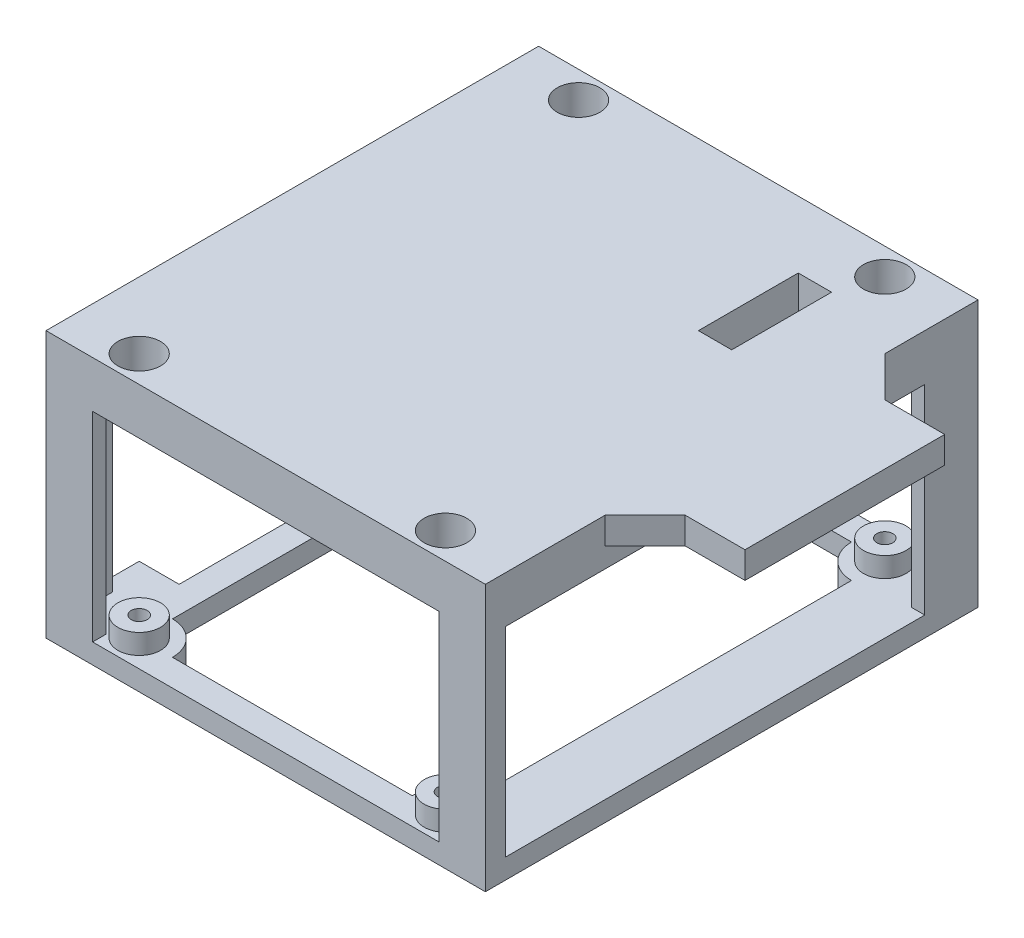
from build123d import *

# Parameters (mm, degrees)
SKETCH1_W                             = 66
SKETCH1_H                             = 74
SKETCH1_R                             = 1.2
MAIN_OUTER_CONNECTION_DEPTH           = 40
SKETCH2_W                             = 62
SKETCH2_H                             = 30
HOLE_FOR_PROTOBOARD_ACCESS_DEPTH      = 107.920531237
SKETCH16_W                            = 5
SKETCH16_H                            = 30
WALL_FOR_SCREW_TERMINAL_REPLACE_DEPTH = 2
SKETCH18_W                            = 58
SKETCH18_H                            = 30
HOLE_FOR_WIRE_CONNECTIONS_DEPTH       = 107.920531237
HOLE_FOR_SCREW_TERMINAL_REPLACE_REACH = 108.921
SKETCH18_3_W                          = 5
SKETCH18_3_H                          = 30
SKETCH1_3_W                           = 6
SKETCH1_3_H                           = 46
HOLE_FOR_WIRE_IN_BOTTOM_DEPTH         = 10
BOLT_START                            = 33
SKETCH1_5_R                           = 3.2
SKETCH1_5_R_2                         = 1.2
BOLT_HEAD_CLEARANCE_DEPTH             = 7
STANDOFF_START                        = 3
SKETCH1_6_R                           = 3.2
SKETCH1_6_R_2                         = 1.2
STANDOFF_FOR_WIRE_CLEARANCE_DEPTH     = 3
BREAKOUT_START                        = 36
SKETCH1_8_W                           = 15
SKETCH1_8_H                           = 30
BREAKOUT_BOARD_COVER_DEPTH            = 4
CUT_EXTRUDE14_START                   = 40
SKETCH1_9_W                           = 5
SKETCH1_9_H                           = 15
CUT_EXTRUDE14_DEPTH                   = 7
CHAMFER2_SIZE                         = 6


with BuildPart() as part:
    # Sketch1 → Main Outer Connection (new body)
    with BuildSketch(Plane(origin=(0, 0, 0), x_dir=(1, 0, 0), z_dir=(0, 1, 0))):
        with Locations((33, 37)):
            Rectangle(SKETCH1_W, SKETCH1_H)
        with Locations(Location((10, 70, 0), (0, 0, 270))):
            Circle(SKETCH1_R, mode=Mode.SUBTRACT)
        with Locations(Location((56, 70, 0), (0, 0, 270))):
            Circle(SKETCH1_R, mode=Mode.SUBTRACT)
        with Locations(Location((10, 4, 0), (0, 0, 270))):
            Circle(SKETCH1_R, mode=Mode.SUBTRACT)
        with Locations(Location((56, 4, 0), (0, 0, 270))):
            Circle(SKETCH1_R, mode=Mode.SUBTRACT)
    extrude(amount=MAIN_OUTER_CONNECTION_DEPTH)

    # Sketch2 → Hole for Protoboard Access (cut, through all)
    with BuildSketch(Plane(origin=(0, 0, -74), x_dir=(-1, 0, 0), z_dir=(0, 0, -1))):
        with Locations((-33, 18)):
            Rectangle(SKETCH2_W, SKETCH2_H)
    extrude(amount=-HOLE_FOR_PROTOBOARD_ACCESS_DEPTH, mode=Mode.SUBTRACT)

    # Sketch16 → Wall for Screw Terminal Replace (add)
    with BuildSketch(Plane.XY):
        with Locations((61.5, 18)):
            Rectangle(SKETCH16_W, SKETCH16_H)
        with Locations((4.5, 18)):
            Rectangle(SKETCH16_W, SKETCH16_H)
    extrude(amount=-WALL_FOR_SCREW_TERMINAL_REPLACE_DEPTH)

    # Sketch18 → Hole for Wire Connections (cut, through all)
    with BuildSketch(Plane(origin=(66, 0, 0), x_dir=(0, 0, -1), z_dir=(1, 0, 0))):
        with Locations((37, 18)):
            Rectangle(SKETCH18_W, SKETCH18_H)
    extrude(amount=-HOLE_FOR_WIRE_CONNECTIONS_DEPTH, mode=Mode.SUBTRACT)

    # Sketch18<3> → Hole for Screw Terminal Replace (cut, up to next)
    with BuildSketch(Plane(origin=(66, 0, 0), x_dir=(0, 0, -1), z_dir=(1, 0, 0)), mode=Mode.PRIVATE) as hole_for_screw_terminal_replace_sk1:
        with Locations((5.5, 18)):
            Rectangle(SKETCH18_3_W, SKETCH18_3_H)
    hole_for_screw_terminal_replace_tool1 = extrude(hole_for_screw_terminal_replace_sk1.sketch, amount=-HOLE_FOR_SCREW_TERMINAL_REPLACE_REACH, mode=Mode.PRIVATE) & part.part
    add(hole_for_screw_terminal_replace_tool1.solids().sort_by_distance((66, 18, -5.5))[0], mode=Mode.SUBTRACT)

    # Sketch1<3> → Hole for Wire in Bottom (cut)
    with BuildSketch(Plane(origin=(0, 0, 0), x_dir=(1, 0, 0), z_dir=(0, 1, 0))):
        with Locations((3, 37)):
            Rectangle(SKETCH1_3_W, SKETCH1_3_H)
        with BuildLine():
            Line((51, 70), (15, 70))
            ThreePointArc((15, 70), (13.535533906, 66.464466094), (10, 65))
            Line((10, 65), (10, 9))
            ThreePointArc((10, 9), (13.535533906, 7.535533906), (15, 4))
            Line((15, 4), (51, 4))
            ThreePointArc((51, 4), (52.464466094, 7.535533906), (56, 9))
            Line((56, 9), (56, 65))
            ThreePointArc((56, 65), (52.464466094, 66.464466094), (51, 70))
        make_face()
    extrude(amount=HOLE_FOR_WIRE_IN_BOTTOM_DEPTH, mode=Mode.SUBTRACT)

    # Sketch1<5> → Bolt Head Clearance (cut)
    # profile 1 of 4: a face of its own
    with BuildSketch(Plane(origin=(0, 0, 0), x_dir=(1, 0, 0), z_dir=(0, 1, 0)).offset(BOLT_START)):
        with Locations(Location((56, 4, 0), (0, 0, 270))):
            Circle(SKETCH1_5_R)
        with Locations(Location((56, 4, 0), (0, 0, 90))):
            Circle(SKETCH1_5_R_2, mode=Mode.SUBTRACT)
    # profile 2 of 4: a face of its own
    with BuildSketch(Plane(origin=(0, 0, 0), x_dir=(1, 0, 0), z_dir=(0, 1, 0)).offset(BOLT_START)):
        with Locations(Location((10, 4, 0), (0, 0, 270))):
            Circle(SKETCH1_5_R)
        with Locations(Location((10, 4, 0), (0, 0, 90))):
            Circle(SKETCH1_5_R_2, mode=Mode.SUBTRACT)
    # profile 3 of 4: a face of its own
    with BuildSketch(Plane(origin=(0, 0, 0), x_dir=(1, 0, 0), z_dir=(0, 1, 0)).offset(BOLT_START)):
        with Locations(Location((10, 70, 0), (0, 0, 270))):
            Circle(SKETCH1_5_R)
        with Locations(Location((10, 70, 0), (0, 0, 90))):
            Circle(SKETCH1_5_R_2, mode=Mode.SUBTRACT)
    # profile 4 of 4: a face of its own
    with BuildSketch(Plane(origin=(0, 0, 0), x_dir=(1, 0, 0), z_dir=(0, 1, 0)).offset(BOLT_START)):
        with Locations(Location((56, 70, 0), (0, 0, 270))):
            Circle(SKETCH1_5_R)
        with Locations(Location((56, 70, 0), (0, 0, 90))):
            Circle(SKETCH1_5_R_2, mode=Mode.SUBTRACT)
    extrude(amount=BOLT_HEAD_CLEARANCE_DEPTH, mode=Mode.SUBTRACT)

    # Sketch1<6> → Standoff for Wire Clearance (add)
    # profile 1 of 4: a face of its own
    with BuildSketch(Plane(origin=(0, 0, 0), x_dir=(1, 0, 0), z_dir=(0, 1, 0)).offset(STANDOFF_START)):
        with Locations(Location((10, 4, 0), (0, 0, 270))):
            Circle(SKETCH1_6_R)
        with Locations(Location((10, 4, 0), (0, 0, 90))):
            Circle(SKETCH1_6_R_2, mode=Mode.SUBTRACT)
    # profile 2 of 4: a face of its own
    with BuildSketch(Plane(origin=(0, 0, 0), x_dir=(1, 0, 0), z_dir=(0, 1, 0)).offset(STANDOFF_START)):
        with Locations(Location((56, 4, 0), (0, 0, 270))):
            Circle(SKETCH1_6_R)
        with Locations(Location((56, 4, 0), (0, 0, 90))):
            Circle(SKETCH1_6_R_2, mode=Mode.SUBTRACT)
    # profile 3 of 4: a face of its own
    with BuildSketch(Plane(origin=(0, 0, 0), x_dir=(1, 0, 0), z_dir=(0, 1, 0)).offset(STANDOFF_START)):
        with Locations(Location((56, 70, 0), (0, 0, 270))):
            Circle(SKETCH1_6_R)
        with Locations(Location((56, 70, 0), (0, 0, 90))):
            Circle(SKETCH1_6_R_2, mode=Mode.SUBTRACT)
    # profile 4 of 4: a face of its own
    with BuildSketch(Plane(origin=(0, 0, 0), x_dir=(1, 0, 0), z_dir=(0, 1, 0)).offset(STANDOFF_START)):
        with Locations(Location((10, 70, 0), (0, 0, 270))):
            Circle(SKETCH1_6_R)
        with Locations(Location((10, 70, 0), (0, 0, 90))):
            Circle(SKETCH1_6_R_2, mode=Mode.SUBTRACT)
    extrude(amount=STANDOFF_FOR_WIRE_CLEARANCE_DEPTH)

    # Sketch1<8> → Breakout Board Cover (add)
    with BuildSketch(Plane(origin=(0, 0, 0), x_dir=(1, 0, 0), z_dir=(0, 1, 0)).offset(BREAKOUT_START)):
        with Locations((73.5, 39)):
            Rectangle(SKETCH1_8_W, SKETCH1_8_H)
    extrude(amount=BREAKOUT_BOARD_COVER_DEPTH)

    # Sketch1<9> → Cut-Extrude14 (cut)
    with BuildSketch(Plane(origin=(0, 0, 0), x_dir=(1, 0, 0), z_dir=(0, 1, 0)).offset(CUT_EXTRUDE14_START)):
        with Locations((51.5, 56.5)):
            Rectangle(SKETCH1_9_W, SKETCH1_9_H)
    extrude(amount=-CUT_EXTRUDE14_DEPTH, mode=Mode.SUBTRACT)

    # Chamfer2
    chamfer2_edges = [part.edges().sort_by_distance(p)[0] for p in [
        (66, 38, -24),
        (66, 38, -54),
    ]]
    chamfer(chamfer2_edges, length=CHAMFER2_SIZE)


solid = part.part
